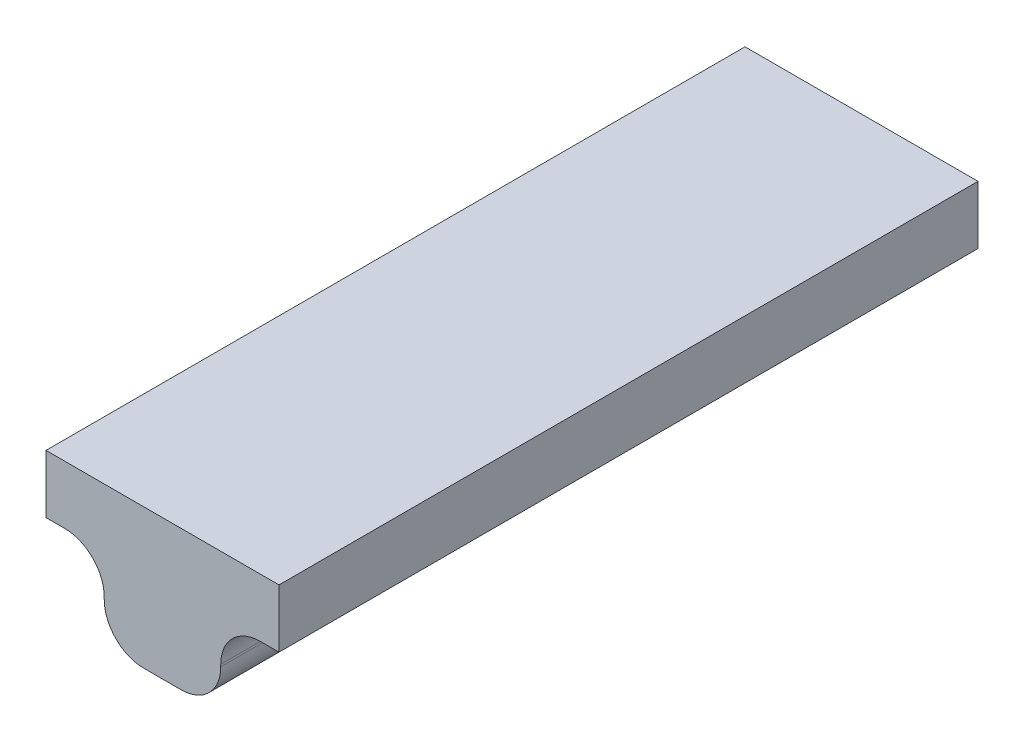
from build123d import *

# Parameters (mm, degrees)
EXTRUDE_1_DEPTH = 6


with BuildPart() as part:
    # 草图1 → 凸台-拉伸1 (new body)
    with BuildSketch(Plane.XY):
        with BuildLine():
            Line((-1, 0), (1, 0))
            Line((1, 0), (1, -0.5))
            Line((1, -0.5), (0.84, -0.5))
            ThreePointArc((0.84, -0.5), (0.599583694, -0.599583694), (0.5, -0.84))
            Line((0.5, -0.84), (0.5, -0.86))
            ThreePointArc((0.5, -0.86), (0.400416306, -1.100416306), (0.16, -1.2))
            Line((0.16, -1.2), (-0.16, -1.2))
            ThreePointArc((-0.16, -1.2), (-0.400416306, -1.100416306), (-0.5, -0.86))
            Line((-0.5, -0.86), (-0.5, -0.84))
            ThreePointArc((-0.5, -0.84), (-0.599583694, -0.599583694), (-0.84, -0.5))
            Line((-0.84, -0.5), (-1, -0.5))
            Line((-1, -0.5), (-1, 0))
        make_face()
    extrude(amount=EXTRUDE_1_DEPTH)


solid = part.part
